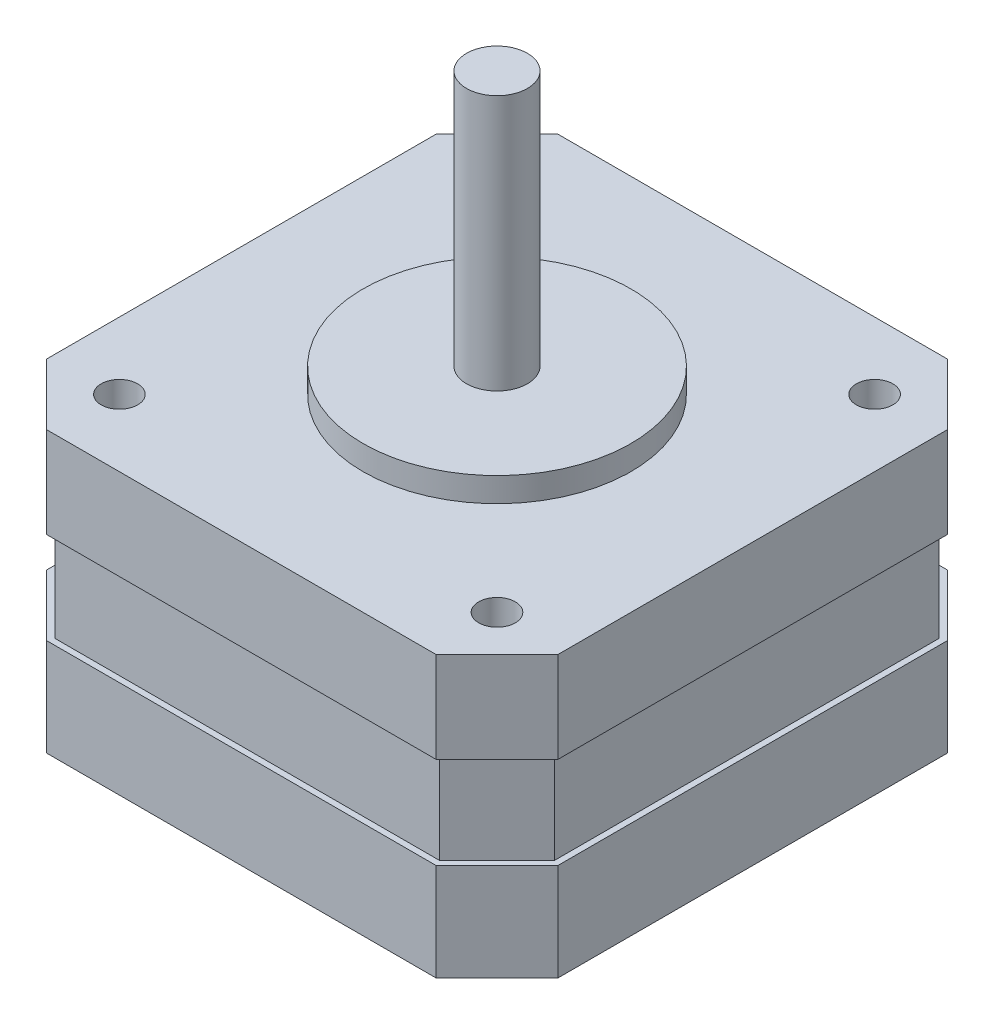
from build123d import *

# Parameters (mm, degrees)
EXTRUDE_1_DEPTH     = 23
SKETCH_1_3_R        = 2.5
EXTRUDE_2_DEPTH     = 23
SKETCH_1_4_R        = 11
SKETCH_1_4_R_2      = 2.5
EXTRUDE_3_DEPTH     = 2
SKETCH_1_5_R        = 1.5
CUT_EXTRUDE_1_DEPTH = 10
SKETCH_2_W          = 32
SKETCH_2_H          = 7.5432644
CUT_EXTRUDE_2_DEPTH = 0.5
SKETCH_9_W          = 7.071067812
SKETCH_9_H          = 7.5432644
CUT_EXTRUDE_3_DEPTH = 0.5
SKETCH_8_W          = 32
SKETCH_8_H          = 7.5432644
CUT_EXTRUDE_4_DEPTH = 0.5
SKETCH_7_W          = 7.071067812
SKETCH_7_H          = 7.5432644
CUT_EXTRUDE_5_DEPTH = 0.5
SKETCH_6_W          = 32
SKETCH_6_H          = 7.5432644
CUT_EXTRUDE_6_DEPTH = 0.5
SKETCH_5_W          = 7.071067812
SKETCH_5_H          = 7.5432644
CUT_EXTRUDE_7_DEPTH = 0.5
SKETCH_4_W          = 32
SKETCH_4_H          = 7.5432644
CUT_EXTRUDE_8_DEPTH = 0.5
SKETCH_3_W          = 7.071067812
SKETCH_3_H          = 7.5432644
CUT_EXTRUDE_9_DEPTH = 0.5


with BuildPart() as part:
    # Эскиз1 → Бобышка-Вытянуть1 (new body)
    with BuildSketch(Plane(origin=(0, 0, 0), x_dir=(1, 0, 0), z_dir=(0, 1, 0))):
        Polygon((-21, -16), (-16, -21), (16, -21), (21, -16), (21, 16), (16, 21), (-16, 21), (-21, 16), align=None)
    extrude(amount=-EXTRUDE_1_DEPTH)

    # Эскиз1<3> → Бобышка-Вытянуть2 (add)
    with BuildSketch(Plane(origin=(0, 0, 0), x_dir=(1, 0, 0), z_dir=(0, 1, 0))):
        Circle(SKETCH_1_3_R)
    extrude(amount=EXTRUDE_2_DEPTH)

    # Эскиз1<4> → Бобышка-Вытянуть3 (add)
    with BuildSketch(Plane(origin=(0, 0, 0), x_dir=(1, 0, 0), z_dir=(0, 1, 0))):
        Circle(SKETCH_1_4_R)
        Circle(SKETCH_1_4_R_2, mode=Mode.SUBTRACT)
    extrude(amount=EXTRUDE_3_DEPTH)

    # Эскиз1<5> → Вырез-Вытянуть1 (cut)
    with BuildSketch(Plane(origin=(0, 0, 0), x_dir=(1, 0, 0), z_dir=(0, 1, 0))):
        with Locations((-15.5, -15.5)):
            Circle(SKETCH_1_5_R)
        with Locations((15.5, -15.5)):
            Circle(SKETCH_1_5_R)
        with Locations((-15.5, 15.5)):
            Circle(SKETCH_1_5_R)
        with Locations((15.5, 15.5)):
            Circle(SKETCH_1_5_R)
    extrude(amount=-CUT_EXTRUDE_1_DEPTH, mode=Mode.SUBTRACT)

    # Эскиз2 → Вырез-Вытянуть2 (cut)
    with BuildSketch(Plane(origin=(0, 0, -21), x_dir=(-1, 0, 0), z_dir=(0, 0, -1))):
        with Locations((0, -11.2283678)):
            Rectangle(SKETCH_2_W, SKETCH_2_H)
    extrude(amount=-CUT_EXTRUDE_2_DEPTH, mode=Mode.SUBTRACT)

    # Эскиз9 → Вырез-Вытянуть3 (cut)
    with BuildSketch(Plane(origin=(-18.5, 0, -18.5), x_dir=(-0.7071067811865458, 0, 0.7071067811865492), z_dir=(-0.7071067811865492, 0, -0.7071067811865458))):
        with Locations((0, -11.2283678)):
            Rectangle(SKETCH_9_W, SKETCH_9_H)
    extrude(amount=-CUT_EXTRUDE_3_DEPTH, mode=Mode.SUBTRACT)

    # Эскиз8 → Вырез-Вытянуть4 (cut)
    with BuildSketch(Plane.ZY.offset(21)):
        with Locations((0, -11.2283678)):
            Rectangle(SKETCH_8_W, SKETCH_8_H)
    extrude(amount=-CUT_EXTRUDE_4_DEPTH, mode=Mode.SUBTRACT)

    # Эскиз7 → Вырез-Вытянуть5 (cut)
    with BuildSketch(Plane(origin=(-18.5, 0, 18.5), x_dir=(0.7071067811865475, 0, 0.7071067811865477), z_dir=(-0.7071067811865477, 0, 0.7071067811865475))):
        with Locations((0, -11.2283678)):
            Rectangle(SKETCH_7_W, SKETCH_7_H)
    extrude(amount=-CUT_EXTRUDE_5_DEPTH, mode=Mode.SUBTRACT)

    # Эскиз6 → Вырез-Вытянуть6 (cut)
    with BuildSketch(Plane.XY.offset(21)):
        with Locations((0, -11.2283678)):
            Rectangle(SKETCH_6_W, SKETCH_6_H)
    extrude(amount=-CUT_EXTRUDE_6_DEPTH, mode=Mode.SUBTRACT)

    # Эскиз5 → Вырез-Вытянуть7 (cut)
    with BuildSketch(Plane(origin=(18.5, 0, 18.5), x_dir=(0.7071067811865483, 0, -0.7071067811865468), z_dir=(0.7071067811865468, 0, 0.7071067811865483))):
        with Locations((0, -11.2283678)):
            Rectangle(SKETCH_5_W, SKETCH_5_H)
    extrude(amount=-CUT_EXTRUDE_7_DEPTH, mode=Mode.SUBTRACT)

    # Эскиз4 → Вырез-Вытянуть8 (cut)
    with BuildSketch(Plane(origin=(21, 0, 0), x_dir=(0, 0, -1), z_dir=(1, 0, 0))):
        with Locations((0, -11.2283678)):
            Rectangle(SKETCH_4_W, SKETCH_4_H)
    extrude(amount=-CUT_EXTRUDE_8_DEPTH, mode=Mode.SUBTRACT)

    # Эскиз3 → Вырез-Вытянуть9 (cut)
    with BuildSketch(Plane(origin=(18.5, 0, -18.5), x_dir=(-0.7071067811865483, 0, -0.7071067811865468), z_dir=(0.7071067811865468, 0, -0.7071067811865483))):
        with Locations((0, -11.2283678)):
            Rectangle(SKETCH_3_W, SKETCH_3_H)
    extrude(amount=-CUT_EXTRUDE_9_DEPTH, mode=Mode.SUBTRACT)


solid = part.part
